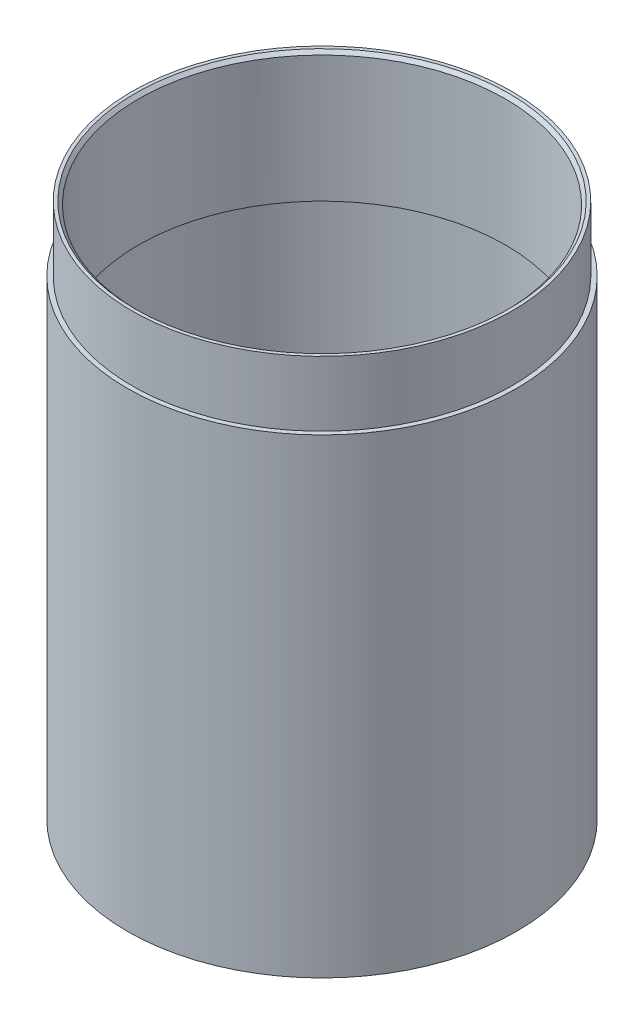
from build123d import *

# Parameters (mm, degrees)
CHAMFER1_SIZE = 0.635


with BuildPart() as part:
    # Sketch1 → Revolve1 (revolve)
    with BuildSketch(Plane.XY, mode=Mode.PRIVATE) as revolve1_sk:
        Polygon((35.941, 30.626891832), (35.941, 5.226891832), (36.703, 5.226891832), (36.703, -74.148108168), (38.1, -74.148108168), (38.1, 17.926891832), (37.211, 17.926891832), (37.211, 30.626891832), align=None)
    revolve(revolve1_sk.sketch.rotate(Axis((0, -31.38958184, 0), (0, 1, 0)), 90), axis=Axis((0, -31.38958184, 0), (0, 1, 0)))

    # Chamfer1
    chamfer1_edges = [part.edges().sort_by_distance(p)[0] for p in [
        (0, 30.626891832, 35.941),
        (0, -74.148108168, 36.703),
    ]]
    chamfer(chamfer1_edges, length=CHAMFER1_SIZE)


solid = part.part
